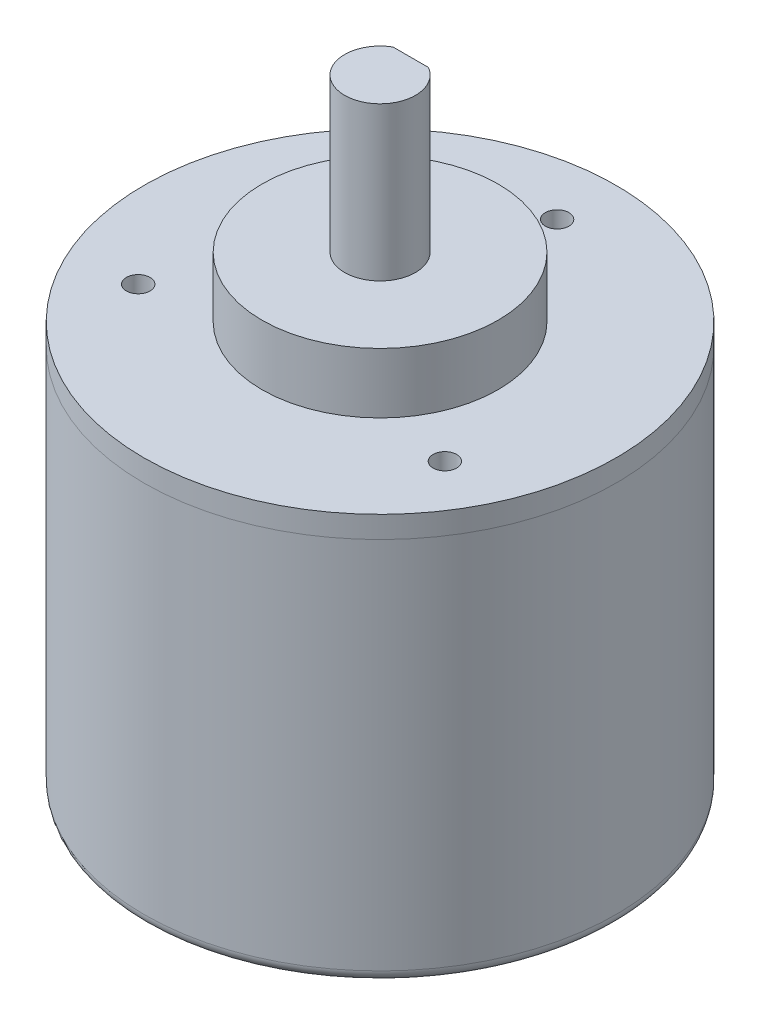
from build123d import *

# Parameters (mm, degrees)
IZIM1_R                     = 20
Y_KSEKLIK_EKSTR_ZYON1_DEPTH = 32.65
IZIM2_R                     = 20
Y_KSEKLIK_EKSTR_ZYON2_DEPTH = 1.85
IZIM3_R                     = 10
Y_KSEKLIK_EKSTR_ZYON3_DEPTH = 5.1
IZIM4_R                     = 1
KES_EKSTR_ZYON1_DEPTH       = 10
RADYUS1_R                   = 1
Y_KSEKLIK_EKSTR_ZYON4_DEPTH = 13


with BuildPart() as part:
    # Çizim1 → Yükseklik-Ekstrüzyon1 (new body)
    with BuildSketch(Plane(origin=(0, 0, 0), x_dir=(1, 0, 0), z_dir=(0, 1, 0))):
        with Locations(Location((0, 0, 0), (0, 0, 270))):
            Circle(IZIM1_R)
    extrude(amount=Y_KSEKLIK_EKSTR_ZYON1_DEPTH)


with BuildPart() as body_2:
    # Çizim2 → Yükseklik-Ekstrüzyon2 (new body)
    with BuildSketch(Plane(origin=(0, 32.65, 0), x_dir=(1, 0, 0), z_dir=(0, 1, 0))):
        with Locations(Location((0, 0, 0), (0, 0, 270))):
            Circle(IZIM2_R)
    extrude(amount=Y_KSEKLIK_EKSTR_ZYON2_DEPTH)

    # Çizim3 → Yükseklik-Ekstrüzyon3 (add)
    with BuildSketch(Plane(origin=(0, 34.5, 0), x_dir=(1, 0, 0), z_dir=(0, 1, 0))):
        with Locations(Location((0, 0, 0), (0, 0, 270))):
            Circle(IZIM3_R)
    extrude(amount=Y_KSEKLIK_EKSTR_ZYON3_DEPTH)


with BuildPart() as kes_ekstr_zyon1_tool:
    # Çizim4 → Kes-Ekstrüzyon1 (new body)
    with BuildSketch(Plane(origin=(0, 34.5, 0), x_dir=(1, 0, 0), z_dir=(0, 1, 0))):
        with Locations(Location((0, 15, 0), (0, 0, 270))):
            Circle(IZIM4_R)
        with Locations(Location((12.990381057, -7.5, 0), (0, 0, 270))):
            Circle(IZIM4_R)
        with Locations(Location((-12.990381057, -7.5, 0), (0, 0, 270))):
            Circle(IZIM4_R)
    extrude(amount=-KES_EKSTR_ZYON1_DEPTH)


with BuildPart() as part_1:
    add(part.part)

    # Kes-Ekstrüzyon1: cut by kes_ekstr_zyon1_tool
    add(kes_ekstr_zyon1_tool.part, mode=Mode.SUBTRACT)

    # Radyus1
    radyus1_edges = [part_1.edges().sort_by_distance(p)[0] for p in [
        (0, 0, -20),
    ]]
    fillet(radyus1_edges, radius=RADYUS1_R)


with BuildPart() as body_2_1:
    add(body_2.part)

    # Kes-Ekstrüzyon1: cut by kes_ekstr_zyon1_tool
    add(kes_ekstr_zyon1_tool.part, mode=Mode.SUBTRACT)

    # Çizim5 → Yükseklik-Ekstrüzyon4 (add)
    with BuildSketch(Plane(origin=(0, 39.6, 0), x_dir=(1, 0, 0), z_dir=(0, 1, 0))):
        with BuildLine():
            Line((-1.5, 2.598076211), (1.5, 2.598076211))
            ThreePointArc((1.5, 2.598076211), (0, -3), (-1.5, 2.598076211))
        make_face()
    extrude(amount=Y_KSEKLIK_EKSTR_ZYON4_DEPTH)


solid = Compound([part_1.part, body_2_1.part])
